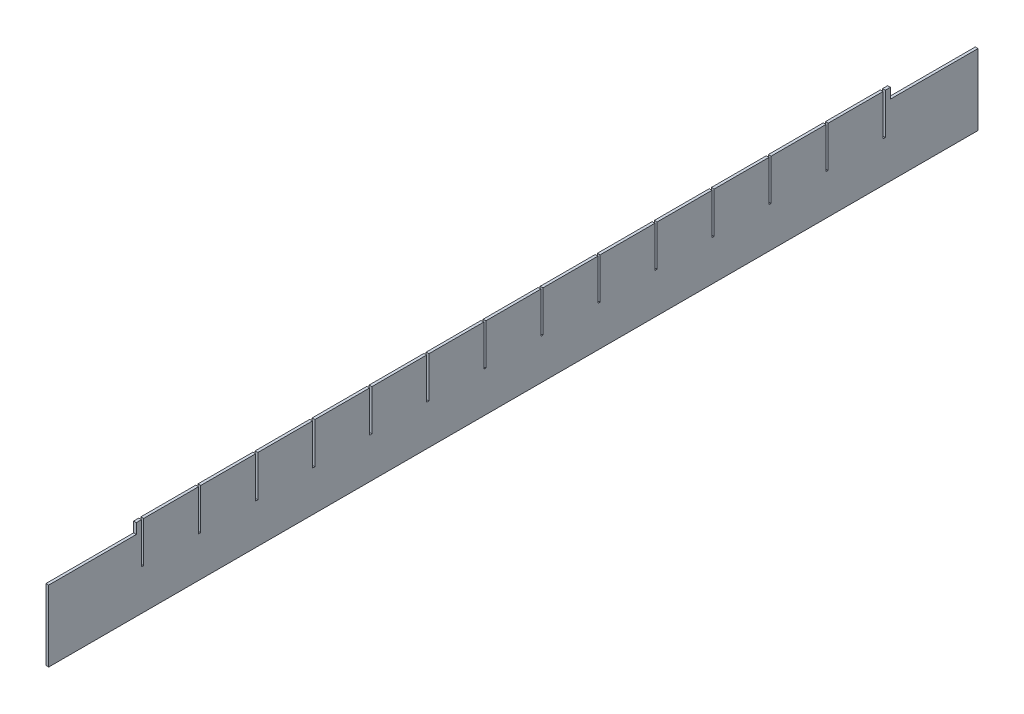
from build123d import *

# Parameters (mm, degrees)
MIDDLE_DEPTH     = 0.8
LPATTERN3_COUNT  = 13
LPATTERN3_PITCH  = 33.333333
FIRST_DEPTH      = 0.8
FIRST_DEPTH_BACK = 0.8
LAST_DEPTH       = 0.8
LAST_DEPTH_BACK  = 0.8


with BuildPart() as part:
    # MiddlePart → Middle (new, symmetric)
    with BuildSketch(Plane(origin=(0, 0, 0), x_dir=(0, 0, -1), z_dir=(1, 0, 0))):
        Polygon((-33.333333, 23.59), (-33.333333, 0), (0, 0), (0, 23.59), (-0.64, 23.59), (-0.64, 47.5), (-32.693333, 47.5), (-32.693333, 23.59), align=None)
    extrude(amount=MIDDLE_DEPTH, both=True)

    # LPattern3: part ×13


with BuildPart() as part_1:
    add(part.part)
    with Locations(*[(0, 0, i * LPATTERN3_PITCH) for i in range(1, LPATTERN3_COUNT)]):
        add(part.part)

    # FirstPart → First (add, two sides: drawn at the far end of the back side and taken through both)
    with BuildSketch(Plane(origin=(0, 0, 0), x_dir=(0, 0, -1), z_dir=(1, 0, 0)).offset(-FIRST_DEPTH_BACK)):
        Polygon((0, 23.59), (0, 0), (54.8333355, 0), (54.8333355, 41.5), (3.64, 41.5), (3.64, 47.5), (0.64, 47.5), (0.64, 23.59), align=None)
    extrude(amount=FIRST_DEPTH + FIRST_DEPTH_BACK)

    # LastPart → Last (add, two sides: drawn at the far end of the back side and taken through both)
    with BuildSketch(Plane(origin=(0, 0, 0), x_dir=(0, 0, -1), z_dir=(1, 0, 0)).offset(-LAST_DEPTH_BACK)):
        Polygon((-436.973329, 47.5), (-433.973329, 47.5), (-433.973329, 23.59), (-433.333329, 23.59), (-433.333329, 0), (-488.1666645, 0), (-488.1666645, 41.5), (-436.973329, 41.5), align=None)
    extrude(amount=LAST_DEPTH + LAST_DEPTH_BACK)


solid = part_1.part
